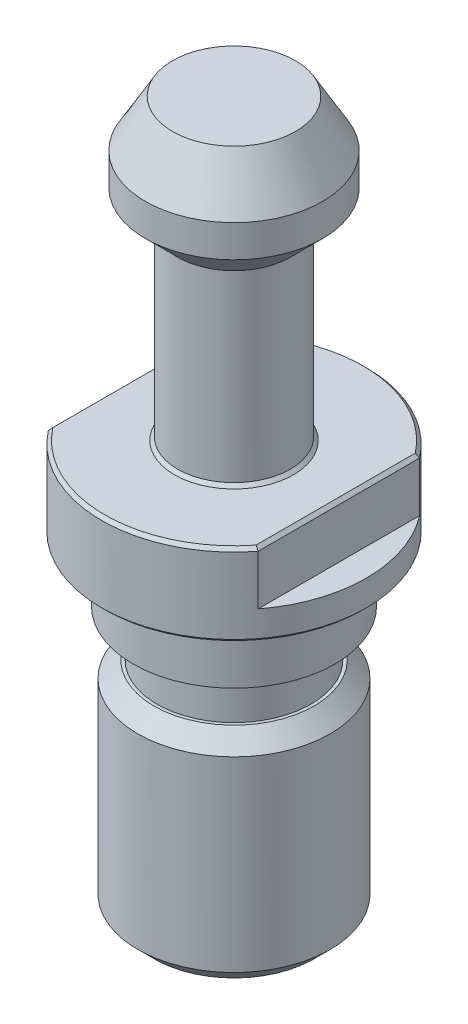
from build123d import *

# Parameters (mm, degrees)
CHAMFER1_SIZE      = 1
SKETCH2_OUTSIDE_W  = 28.378
SKETCH2_OUTSIDE_H  = 28.378
CUT_EXTRUDE1_DEPTH = 3.3
CHAMFER2_SIZE      = 0.2


with BuildPart() as part:
    # Sketch1 → Revolve1 (revolve)
    with BuildSketch(Plane.XY, mode=Mode.PRIVATE) as revolve1_sk:
        Polygon((0, 0), (5.975, 0), (5.975, 13.6), (4.785, 13.6), (4.785, 16.5), (6.265, 16.5), (6.265, 20.3), (8.22, 20.3), (8.22, 25.4), (3.5, 25.4), (3.5, 37), (5.5, 39), (5.5, 41), (3.814137214, 43.92), (0, 43.92), align=None)
    revolve(revolve1_sk.sketch.rotate(Axis((0, 0, 0), (0, 1, 0)), 90), axis=Axis((0, 0, 0), (0, 1, 0)))

    # Chamfer1
    chamfer1_edges = [part.edges().sort_by_distance(p)[0] for p in [
        (0, 13.6, 5.975),
        (0, 0, 5.975),
    ]]
    chamfer(chamfer1_edges, length=CHAMFER1_SIZE)

    # Sketch2 outside → Cut-Extrude1 (cut)
    with BuildSketch(Plane(origin=(0, 25.4, 0), x_dir=(1, 0, 0), z_dir=(0, 1, 0))):
        Rectangle(SKETCH2_OUTSIDE_W, SKETCH2_OUTSIDE_H)
        with BuildLine():
            Line((6.515, -5.012302365), (6.515, 5.012302365))
            ThreePointArc((6.515, 5.012302365), (0, 8.22), (-6.515, 5.012302365))
            Line((-6.515, 5.012302365), (-6.515, -5.012302365))
            ThreePointArc((-6.515, -5.012302365), (0, -8.22), (6.515, -5.012302365))
        make_face(mode=Mode.SUBTRACT)
    extrude(amount=-CUT_EXTRUDE1_DEPTH, mode=Mode.SUBTRACT)

    # Chamfer2
    chamfer2_edges = [part.edges().sort_by_distance(p)[0] for p in [
        (0, 25.4, 3.5),
        (0, 20.3, 8.22),
        (0, 20.3, 6.265),
        (0, 25.4, 8.22),
        (-3.630927881, 25.4, -7.374602547),
        (6.515, 25.4, 0),
        (-6.515, 25.4, 0),
    ]]
    chamfer(chamfer2_edges, length=CHAMFER2_SIZE)


solid = part.part
